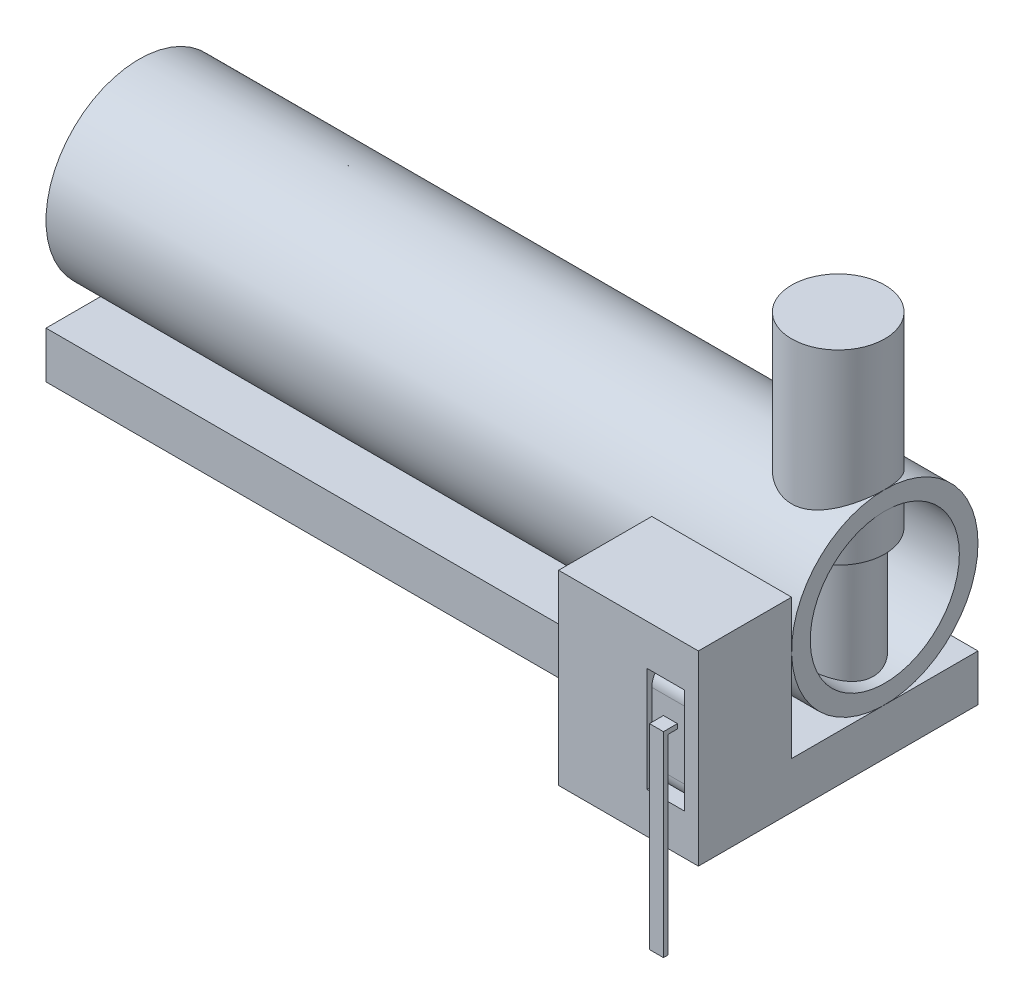
from build123d import *

# Parameters (mm, degrees)
SKETCH3_R                       = 25.4
BOSS_EXTRUDE1_DEPTH             = 203.2
SHELL1_T                        = -5.08
BOSS_EXTRUDE2_DEPTH             = 25.4
BOSS_EXTRUDE2_DEPTH_BACK        = 25.4
SKETCH4_W                       = 203.2
SKETCH4_H                       = 12.7
SKETCH5_W                       = 38.1
SKETCH5_H                       = 50.8
BOSS_EXTRUDE3_DEPTH             = 25.4
SKETCH6_W                       = 10.16
SKETCH6_H                       = 28.575
CUT_EXTRUDE1_DEPTH              = 19.05
BOSS_EXTRUDE4_REACH             = 201.6
SKETCH8_W                       = 3.81
SKETCH8_H                       = 1.27
BOSS_EXTRUDE5_DEPTH             = 2.54
SKETCH10_W                      = 3.81
SKETCH10_H                      = 53.34
BOSS_EXTRUDE6_DEPTH             = 1.27
SKETCH11_R                      = 9.525
BOSS_EXTRUDE7_DEPTH             = 10.16
BOSS_EXTRUDE7_DIRECTION_2_REACH = 221.017
SKETCH12_R                      = 12.7
BOSS_EXTRUDE8_DEPTH             = 50.8


with BuildPart() as part:
    # Sketch3 → Boss-Extrude1 (new body)
    with BuildSketch(Plane(origin=(0, 0, 0), x_dir=(0, 0, -1), z_dir=(1, 0, 0))):
        Circle(SKETCH3_R)
    extrude(amount=-BOSS_EXTRUDE1_DEPTH)

    # Shell1
    shell1_openings = [part.faces().sort_by_distance(p)[0] for p in [
        (0, 0, 0),
    ]]
    offset(amount=SHELL1_T, openings=shell1_openings, kind=Kind.INTERSECTION)

    # Sketch11 → Boss-Extrude7 (add)
    with BuildSketch(Plane(origin=(0, 0, 0), x_dir=(1, 0, 0), z_dir=(0, 1, 0))):
        with Locations((-12.7, 0)):
            Circle(SKETCH11_R)
    extrude(amount=BOSS_EXTRUDE7_DEPTH)

    # Sketch11 → Boss-Extrude7 direction 2 (add, up to next)
    with BuildSketch(Plane(origin=(0, 0, 0), x_dir=(1, 0, 0), z_dir=(0, 1, 0)), mode=Mode.PRIVATE) as boss_extrude7_direction_2_sk1:
        with Locations((-12.7, 0)):
            Circle(SKETCH11_R)
    boss_extrude7_direction_2_tool1 = extrude(boss_extrude7_direction_2_sk1.sketch, amount=-BOSS_EXTRUDE7_DIRECTION_2_REACH, mode=Mode.PRIVATE) - part.part
    add(boss_extrude7_direction_2_tool1.solids().sort_by_distance((-12.7, 0, 0))[0])

    # Sketch12 → Boss-Extrude8 (add)
    with BuildSketch(Plane(origin=(0, 10.16, 0), x_dir=(1, 0, 0), z_dir=(0, 1, 0))):
        with Locations((-12.7, 0)):
            Circle(SKETCH12_R)
    extrude(amount=BOSS_EXTRUDE8_DEPTH)


with BuildPart() as body_2:
    # Sketch4 → Boss-Extrude2 (new, two sides: drawn at the far end of the back side and taken through both)
    with BuildSketch(Plane.XY.offset(-BOSS_EXTRUDE2_DEPTH_BACK)):
        with Locations((-101.6, -31.75)):
            Rectangle(SKETCH4_W, SKETCH4_H)
    extrude(amount=BOSS_EXTRUDE2_DEPTH + BOSS_EXTRUDE2_DEPTH_BACK)

    # Sketch5 → Boss-Extrude3 (add)
    with BuildSketch(Plane.XY.offset(25.4)):
        with Locations((-19.05, -12.7)):
            Rectangle(SKETCH5_W, SKETCH5_H)
    extrude(amount=BOSS_EXTRUDE3_DEPTH)

    # Sketch6 → Cut-Extrude1 (cut)
    with BuildSketch(Plane.XY.offset(50.8)):
        with Locations((-8.89, -12.7)):
            Rectangle(SKETCH6_W, SKETCH6_H)
    extrude(amount=-CUT_EXTRUDE1_DEPTH, mode=Mode.SUBTRACT)

    # Sketch7 → Boss-Extrude4 (add, up to next)
    with BuildSketch(Plane(origin=(-13.97, 0, 0), x_dir=(0, 0, -1), z_dir=(1, 0, 0)), mode=Mode.PRIVATE) as boss_extrude4_sk1:
        with BuildLine():
            Line((-44.45, -26.9875), (-36.83, -26.9875))
            ThreePointArc((-36.83, -26.9875), (-33.237897552, -25.499602448), (-31.75, -21.9075))
            Line((-31.75, -21.9075), (-31.75, -3.4925))
            ThreePointArc((-31.75, -3.4925), (-33.237897552, 0.099602448), (-36.83, 1.5875))
            Line((-36.83, 1.5875), (-44.45, 1.5875))
            ThreePointArc((-44.45, 1.5875), (-48.042102448, 0.099602448), (-49.53, -3.4925))
            Line((-49.53, -3.4925), (-49.53, -21.9075))
            ThreePointArc((-49.53, -21.9075), (-48.042102448, -25.499602448), (-44.45, -26.9875))
        make_face()
    boss_extrude4_tool1 = extrude(boss_extrude4_sk1.sketch, amount=BOSS_EXTRUDE4_REACH, mode=Mode.PRIVATE) - body_2.part
    add(boss_extrude4_tool1.solids().sort_by_distance((-13.97, -12.7, 40.64))[0])

    # Sketch8 → Boss-Extrude5 (add)
    with BuildSketch(Plane.XY.offset(49.53)):
        with Locations((-8.89, -9.2075)):
            Rectangle(SKETCH8_W, SKETCH8_H)
    extrude(amount=BOSS_EXTRUDE5_DEPTH)

    # Sketch10 → Boss-Extrude6 (add)
    with BuildSketch(Plane.XY.offset(52.07)):
        with Locations((-8.89, -35.2425)):
            Rectangle(SKETCH10_W, SKETCH10_H)
    extrude(amount=BOSS_EXTRUDE6_DEPTH)


solid = Compound([part.part, body_2.part])
